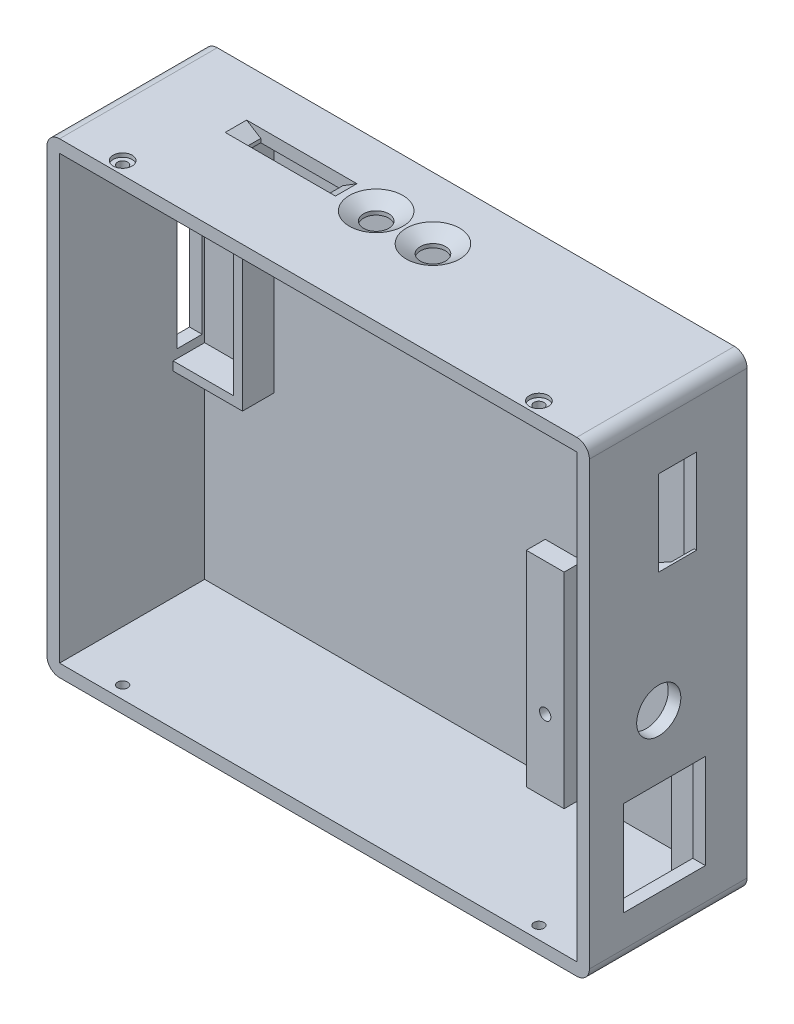
from build123d import *
from OCP.BRepFilletAPI import BRepFilletAPI_MakeChamfer

# Parameters (mm, degrees)
SKETCH1_W           = 86
SKETCH1_H           = 74
BOSS_EXTRUDE1_DEPTH = 25
SKETCH3_W           = 82
SKETCH3_H           = 70
CUT_EXTRUDE1_DEPTH  = 23
SKETCH4_W           = 8
SKETCH4_H           = 37.5
SKETCH4_W_2         = 1.4
BOSS_EXTRUDE2_DEPTH = 5
SKETCH5_W           = 3
SKETCH5_H           = 8
SKETCH5_W_2         = 1
SKETCH5_H_2         = 4
CUT_EXTRUDE2_DEPTH  = 2
SKETCH6_R           = 1
CUT_EXTRUDE3_DEPTH  = 5
SKETCH7_W           = 4
SKETCH7_H           = 35
CUT_EXTRUDE4_DEPTH  = 5
SKETCH8_W           = 6
SKETCH8_H           = 23.5
CUT_EXTRUDE5_DEPTH  = 5
SKETCH9_W           = 5
SKETCH9_H           = 32.5
SKETCH9_W_2         = 6
BOSS_EXTRUDE3_DEPTH = 3
SKETCH10_R          = 0.9
CUT_EXTRUDE6_DEPTH  = 4
SKETCH11_W          = 13
SKETCH11_H          = 15
CUT_EXTRUDE7_DEPTH  = 4
FILLET1_R           = 2
SKETCH12_R          = 3.5
CUT_EXTRUDE8_DEPTH  = 4
SKETCH13_R          = 2
SKETCH13_W          = 13
SKETCH13_H          = 3.4
CUT_EXTRUDE9_DEPTH  = 4
CHAMFER1_SIZE       = 1.4
CHAMFER1_SIZE2      = 2.240468341
SKETCH14_R          = 0.8
CUT_EXTRUDE10_DEPTH = 76
SKETCH15_R          = 1.5
CUT_EXTRUDE11_DEPTH = 0.6
CUT_EXTRUDE12_START = -0.6
SKETCH16_R          = 1.5
CUT_EXTRUDE12_DEPTH = 0.6
SKETCH17_W          = 2
SKETCH17_H          = 10
BOSS_EXTRUDE4_DEPTH = 2.4
SKETCH18_W          = 3.6
SKETCH18_H          = 10
BOSS_EXTRUDE5_DEPTH = 0.4
CHAMFER2_SIZE       = 2
CHAMFER2_SIZE2      = 1.562571253
SKETCH20_W          = 11
SKETCH20_H          = 1.4
BOSS_EXTRUDE6_DEPTH = 5


with BuildPart() as part:
    # Sketch1 → Boss-Extrude1 (new body)
    with BuildSketch(Plane.XY):
        with Locations((43, 37)):
            Rectangle(SKETCH1_W, SKETCH1_H)
    extrude(amount=BOSS_EXTRUDE1_DEPTH)

    # Sketch3 → Cut-Extrude1 (cut)
    with BuildSketch(Plane.XY.offset(25)):
        with Locations((43, 37)):
            Rectangle(SKETCH3_W, SKETCH3_H)
    extrude(amount=-CUT_EXTRUDE1_DEPTH, mode=Mode.SUBTRACT)

    # Sketch4 → Boss-Extrude2 (add)
    with BuildSketch(Plane.XY.offset(2)):
        with Locations((80, 53.25)):
            Rectangle(SKETCH4_W, SKETCH4_H)
        with Locations((12.3, 53.25)):
            Rectangle(SKETCH4_W_2, SKETCH4_H)
    extrude(amount=BOSS_EXTRUDE2_DEPTH)

    # Sketch5 → Cut-Extrude2 (cut)
    with BuildSketch(Plane.XY.offset(7)):
        with Locations((77.5, 58)):
            Rectangle(SKETCH5_W, SKETCH5_H)
        with Locations((76.5, 43.5)):
            Rectangle(SKETCH5_W_2, SKETCH5_H_2)
    extrude(amount=-CUT_EXTRUDE2_DEPTH, mode=Mode.SUBTRACT)

    # Sketch6 → Cut-Extrude3 (cut)
    with BuildSketch(Plane.XY.offset(7)):
        with Locations((80, 67.25)):
            Circle(SKETCH6_R)
        with Locations((80, 39.25)):
            Circle(SKETCH6_R)
    extrude(amount=-CUT_EXTRUDE3_DEPTH, mode=Mode.SUBTRACT)

    # Sketch7 → Cut-Extrude4 (cut)
    with BuildSketch(Plane(origin=(2, 0, 0), x_dir=(0, 0, -1), z_dir=(1, 0, 0))):
        with Locations((-4.4, 53.35)):
            Rectangle(SKETCH7_W, SKETCH7_H)
    extrude(amount=-CUT_EXTRUDE4_DEPTH, mode=Mode.SUBTRACT)

    # Sketch8 → Cut-Extrude5 (cut)
    with BuildSketch(Plane.ZY.offset(-84)):
        with Locations((11, 52.75)):
            Rectangle(SKETCH8_W, SKETCH8_H)
    extrude(amount=-CUT_EXTRUDE5_DEPTH, mode=Mode.SUBTRACT)

    # Sketch9 → Boss-Extrude3 (add)
    with BuildSketch(Plane.XY.offset(2)):
        with Locations((81.5, 18.25)):
            Rectangle(SKETCH9_W, SKETCH9_H)
        with Locations((59, 18.25)):
            Rectangle(SKETCH9_W_2, SKETCH9_H)
    extrude(amount=BOSS_EXTRUDE3_DEPTH)

    # Sketch10 → Cut-Extrude6 (cut)
    with BuildSketch(Plane.XY.offset(5)):
        with Locations((59, 13.5)):
            Circle(SKETCH10_R)
    extrude(amount=-CUT_EXTRUDE6_DEPTH, mode=Mode.SUBTRACT)

    # Sketch11 → Cut-Extrude7 (cut)
    with BuildSketch(Plane.ZY.offset(-84)):
        with Locations((13.1, 14.5)):
            Rectangle(SKETCH11_W, SKETCH11_H)
    extrude(amount=-CUT_EXTRUDE7_DEPTH, mode=Mode.SUBTRACT)

    # Fillet1
    fillet1_edges = [part.edges().sort_by_distance(p)[0] for p in [
        (0, 74, 12.5),
        (86, 74, 12.5),
        (86, 0, 12.5),
        (0, 0, 12.5),
    ]]
    fillet(fillet1_edges, radius=FILLET1_R)

    # Sketch12 → Cut-Extrude8 (cut)
    with BuildSketch(Plane.ZY.offset(-84)):
        with Locations(Location((14, 32, 0), (0, 0, 270))):
            Circle(SKETCH12_R)
    extrude(amount=-CUT_EXTRUDE8_DEPTH, mode=Mode.SUBTRACT)

    # Sketch13 → Cut-Extrude9 (cut)
    with BuildSketch(Plane(origin=(0, 72, 0), x_dir=(-1, 0, 0), z_dir=(0, -1, 0))):
        with Locations(Location((-37, -9.8, 0), (0, 0, 90))):
            Circle(SKETCH13_R)
        with Locations(Location((-46, -9.8, 0), (0, 0, 90))):
            Circle(SKETCH13_R)
        with Locations((-23, -9.3)):
            Rectangle(SKETCH13_W, SKETCH13_H)
    extrude(amount=-CUT_EXTRUDE9_DEPTH, mode=Mode.SUBTRACT)

    # Chamfer1: one chamfer whose edges measure the first distance from different faces: ONE call of the kernel's chamfer builder (chamfer() names one face for all edges)
    chamfer1_edges_1 = [part.edges().sort_by_distance(p)[0] for p in [
        (16.5, 74, 9.3),
    ]]
    chamfer1_side_1 = [part.faces().sort_by_distance(p)[0] for p in [
        (16.5, 73, 9.3),
    ]]
    chamfer1_edges_2 = [part.edges().sort_by_distance(p)[0] for p in [
        (29.5, 74, 9.3),
    ]]
    chamfer1_side_2 = [part.faces().sort_by_distance(p)[0] for p in [
        (29.5, 73, 9.3),
    ]]
    chamfer1_edges_3 = [part.edges().sort_by_distance(p)[0] for p in [
        (37, 74, 11.8),
    ]]
    chamfer1_side_3 = [part.faces().sort_by_distance(p)[0] for p in [
        (37, 73, 11.8),
    ]]
    chamfer1_edges_4 = [part.edges().sort_by_distance(p)[0] for p in [
        (46, 74, 11.8),
    ]]
    chamfer1_side_4 = [part.faces().sort_by_distance(p)[0] for p in [
        (46, 73, 11.8),
    ]]
    chamfer1 = BRepFilletAPI_MakeChamfer(part.part.solid().wrapped)
    for e in chamfer1_edges_1:
        chamfer1.Add(CHAMFER1_SIZE, CHAMFER1_SIZE2, e.wrapped, chamfer1_side_1[0].wrapped)  # the first distance lies on this face
    for e in chamfer1_edges_2:
        chamfer1.Add(CHAMFER1_SIZE, CHAMFER1_SIZE2, e.wrapped, chamfer1_side_2[0].wrapped)  # the first distance lies on this face
    for e in chamfer1_edges_3:
        chamfer1.Add(CHAMFER1_SIZE, CHAMFER1_SIZE2, e.wrapped, chamfer1_side_3[0].wrapped)  # the first distance lies on this face
    for e in chamfer1_edges_4:
        chamfer1.Add(CHAMFER1_SIZE, CHAMFER1_SIZE2, e.wrapped, chamfer1_side_4[0].wrapped)  # the first distance lies on this face
    add(Compound.cast(chamfer1.Shape()), mode=Mode.REPLACE)

    # Sketch14 → Cut-Extrude10 (cut)
    with BuildSketch(Plane(origin=(0, 0, 0), x_dir=(-1, 0, 0), z_dir=(0, -1, 0))):
        with Locations(Location((-10, -23, 0), (0, 0, 90))):
            Circle(SKETCH14_R)
        with Locations(Location((-76, -23, 0), (0, 0, 90))):
            Circle(SKETCH14_R)
    extrude(amount=-CUT_EXTRUDE10_DEPTH, mode=Mode.SUBTRACT)

    # Sketch15 → Cut-Extrude11 (cut)
    with BuildSketch(Plane(origin=(0, 0, 0), x_dir=(-1, 0, 0), z_dir=(0, -1, 0))):
        with Locations(Location((-10, -23, 0), (0, 0, 90))):
            Circle(SKETCH15_R)
        with Locations(Location((-76, -23, 0), (0, 0, 90))):
            Circle(SKETCH15_R)
    extrude(amount=-CUT_EXTRUDE11_DEPTH, mode=Mode.SUBTRACT)

    # Sketch16 → Cut-Extrude12 (cut)
    with BuildSketch(Plane(origin=(0, 74, 0), x_dir=(1, 0, 0), z_dir=(0, 1, 0)).offset(CUT_EXTRUDE12_START)):
        with Locations(Location((76, -23, 0), (0, 0, 90))):
            Circle(SKETCH16_R)
        with Locations(Location((10, -23, 0), (0, 0, 90))):
            Circle(SKETCH16_R)
    extrude(amount=CUT_EXTRUDE12_DEPTH, mode=Mode.SUBTRACT)

    # Sketch17 → Boss-Extrude4 (add)
    with BuildSketch(Plane(origin=(0, 0, 14), x_dir=(-1, 0, 0), z_dir=(0, 0, -1))):
        with Locations((-85, 46)):
            Rectangle(SKETCH17_W, SKETCH17_H)
    extrude(amount=BOSS_EXTRUDE4_DEPTH)

    # Sketch18 → Boss-Extrude5 (add)
    with BuildSketch(Plane(origin=(86, 0, 0), x_dir=(0, 0, -1), z_dir=(1, 0, 0))):
        with Locations((-9.8, 46)):
            Rectangle(SKETCH18_W, SKETCH18_H)
    extrude(amount=-BOSS_EXTRUDE5_DEPTH)

    # Chamfer2
    chamfer2_edges = [part.edges().sort_by_distance(p)[0] for p in [
        (84, 46, 11.6),
    ]]
    chamfer2_side = [part.faces().sort_by_distance(p)[0] for p in [
        (84, 38.391894294, 16.636900107),
    ]]
    chamfer(chamfer2_edges, length=CHAMFER2_SIZE, length2=CHAMFER2_SIZE2, reference=chamfer2_side[0])

    # Sketch20 → Boss-Extrude6 (add)
    with BuildSketch(Plane.XY.offset(2)):
        with Locations((7.5, 33.8)):
            Rectangle(SKETCH20_W, SKETCH20_H)
    extrude(amount=BOSS_EXTRUDE6_DEPTH)


solid = part.part
